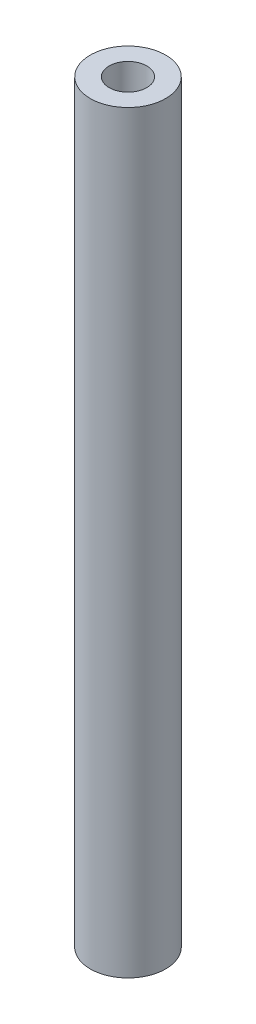
from build123d import *

# Parameters (mm, degrees)
SKETCH_2_R          = 4
EXTRUDE_1_DEPTH     = 80
SKETCH_3_R          = 2
CUT_EXTRUDE_1_DEPTH = 81.199750623


with BuildPart() as part:
    # 草图2 → 凸台-拉伸1 (new body)
    with BuildSketch(Plane(origin=(0, 0, 0), x_dir=(1, 0, 0), z_dir=(0, 1, 0))):
        with Locations(Location((0, 0, 0), (0, 0, 270))):
            Circle(SKETCH_2_R)
    extrude(amount=EXTRUDE_1_DEPTH)

    # 草图3 → 切除-拉伸1 (cut, through all)
    with BuildSketch(Plane(origin=(0, 80, 0), x_dir=(1, 0, 0), z_dir=(0, 1, 0))):
        with Locations(Location((0, 0, 0), (0, 0, 270))):
            Circle(SKETCH_3_R)
    extrude(amount=-CUT_EXTRUDE_1_DEPTH, mode=Mode.SUBTRACT)


solid = part.part
